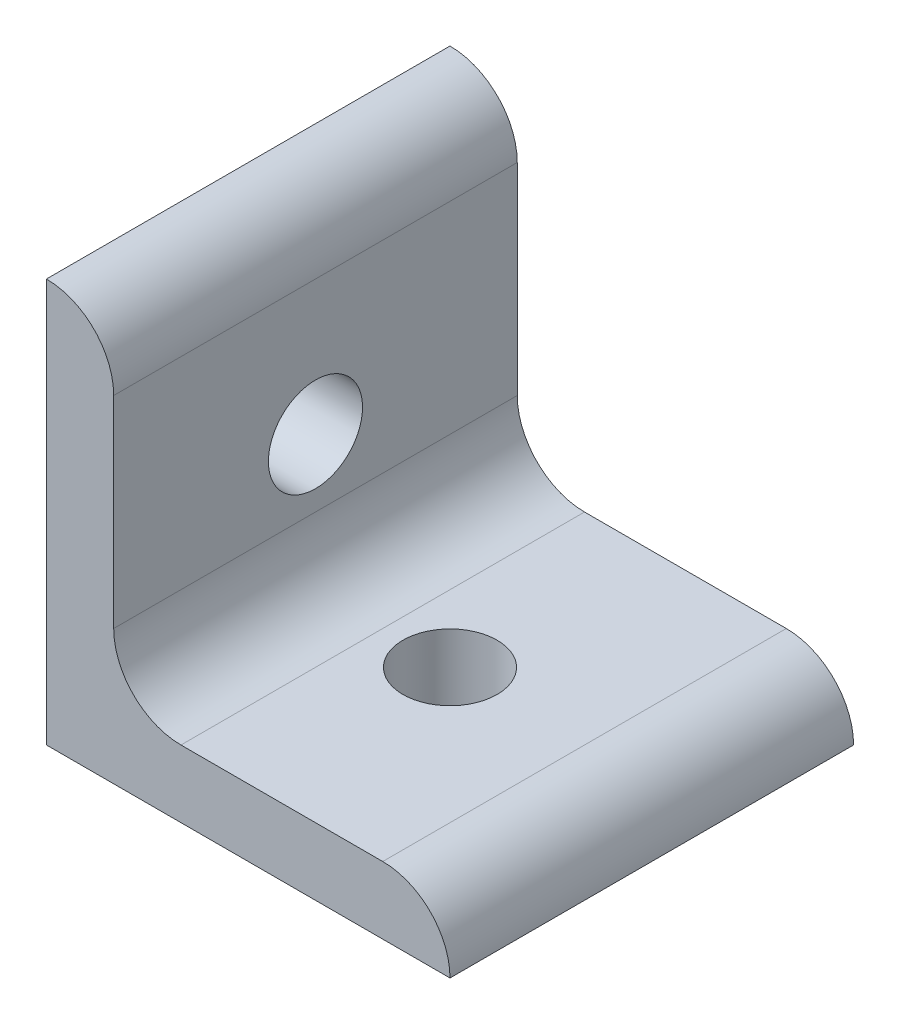
from build123d import *

# Parameters (mm, degrees)
BOSS_EXTRUDE1_DEPTH = 15
SKETCH2_R           = 3.5
CUT_EXTRUDE1_DEPTH  = 46
SKETCH3_R           = 3.5
CUT_EXTRUDE2_DEPTH  = 46


with BuildPart() as part:
    # Sketch1 → Boss-Extrude1 (new, symmetric)
    with BuildSketch(Plane.XY):
        with BuildLine():
            Line((0, 0), (0, 30))
            ThreePointArc((0, 30), (3.535533906, 28.535533906), (5, 25))
            Line((5, 25), (5, 10))
            ThreePointArc((5, 10), (6.464466094, 6.464466094), (10, 5))
            Line((10, 5), (25, 5))
            ThreePointArc((25, 5), (28.535533906, 3.535533906), (30, 0))
            Line((30, 0), (0, 0))
        make_face()
    extrude(amount=BOSS_EXTRUDE1_DEPTH, both=True)

    # Sketch2 → Cut-Extrude1 (cut, through all)
    with BuildSketch(Plane(origin=(0, 0, 0), x_dir=(1, 0, 0), z_dir=(0, 1, 0))):
        with Locations((15, 0)):
            Circle(SKETCH2_R)
    extrude(amount=CUT_EXTRUDE1_DEPTH, mode=Mode.SUBTRACT)

    # Sketch3 → Cut-Extrude2 (cut, through all)
    with BuildSketch(Plane(origin=(0, 0, 0), x_dir=(0, 0, -1), z_dir=(1, 0, 0))):
        with Locations(Location((0, 15, 0), (0, 0, 270))):
            Circle(SKETCH3_R)
    extrude(amount=CUT_EXTRUDE2_DEPTH, mode=Mode.SUBTRACT)


solid = part.part
